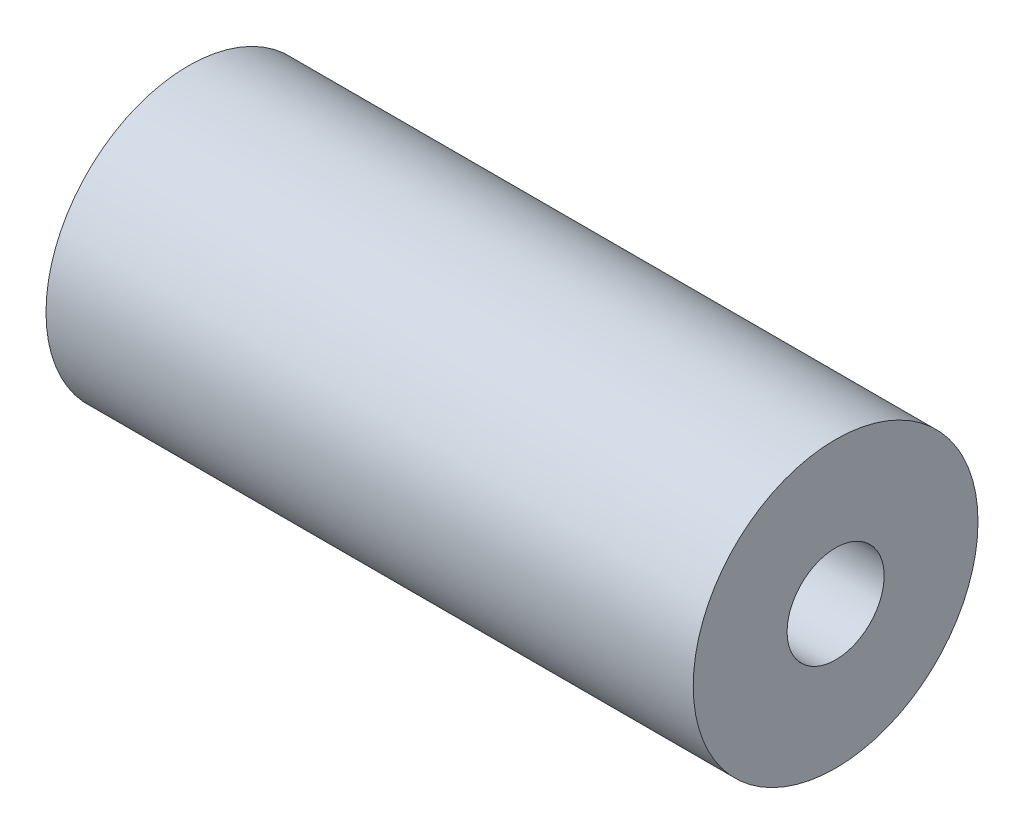
from build123d import *

# Parameters (mm, degrees)
SKETCH1_W = 100
SKETCH1_H = 14.5
SKETCH2_W = 40
SKETCH2_H = 0.5


with BuildPart() as part:
    # Sketch1 → Revolve1 (revolve)
    with BuildSketch(Plane.XY, mode=Mode.PRIVATE) as revolve1_sk:
        with Locations((50, 14.75)):
            Rectangle(SKETCH1_W, SKETCH1_H)
    revolve(revolve1_sk.sketch.rotate(Axis((0, 0, 0), (1, 0, 0)), 90), axis=Axis((0, 0, 0), (1, 0, 0)))

    # Sketch2 → Cut-Revolve1 (revolve, cut)
    with BuildSketch(Plane.XY, mode=Mode.PRIVATE) as cut_revolve1_sk:
        with Locations((50, 7.75)):
            Rectangle(SKETCH2_W, SKETCH2_H)
    revolve(cut_revolve1_sk.sketch.rotate(Axis((0, 0, 0), (1, 0, 0)), 90), axis=Axis((0, 0, 0), (1, 0, 0)), mode=Mode.SUBTRACT)


solid = part.part
